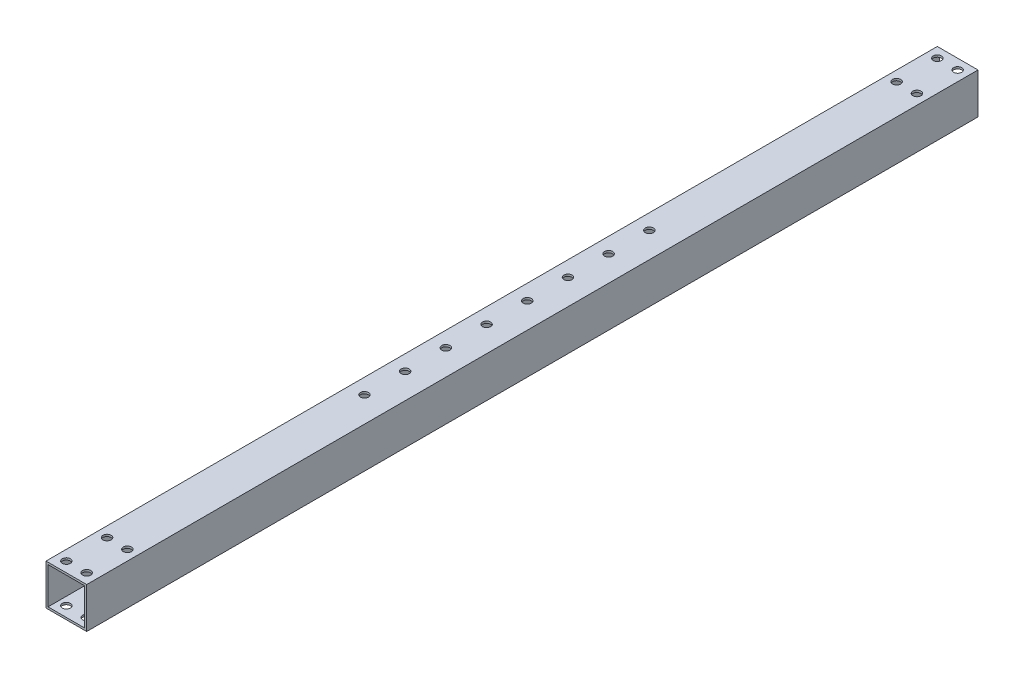
from build123d import *

# Parameters (mm, degrees)
SKETCH_1_W          = 20
SKETCH_1_H          = 20
SKETCH_1_W_2        = 18
SKETCH_1_H_2        = 18
EXTRUDE_1_DEPTH     = 438
SKETCH_4_R          = 2
CUT_EXTRUDE_1_DEPTH = 439.912291922


with BuildPart() as part:
    # 草图1 → 拉伸-薄壁1 (new body)
    with BuildSketch(Plane.XY):
        with Locations((10, 10)):
            Rectangle(SKETCH_1_W, SKETCH_1_H)
        with Locations((10, 10)):
            Rectangle(SKETCH_1_W_2, SKETCH_1_H_2, mode=Mode.SUBTRACT)
    extrude(amount=EXTRUDE_1_DEPTH)

    # 草图4 → 切除-拉伸1 (cut, through all)
    with BuildSketch(Plane(origin=(0, 20, 0), x_dir=(1, 0, 0), z_dir=(0, 1, 0))):
        with Locations(Location((5, -413, 0), (0, 0, 270))):
            Circle(SKETCH_4_R)
        with Locations(Location((15, -413, 0), (0, 0, 270))):
            Circle(SKETCH_4_R)
        with Locations(Location((15, -433, 0), (0, 0, 270))):
            Circle(SKETCH_4_R)
        with Locations(Location((5, -433, 0), (0, 0, 270))):
            Circle(SKETCH_4_R)
        with Locations(Location((5, -5, 0), (0, 0, 90))):
            Circle(SKETCH_4_R)
        with Locations(Location((15, -5, 0), (0, 0, 90))):
            Circle(SKETCH_4_R)
        with Locations(Location((15, -25, 0), (0, 0, 90))):
            Circle(SKETCH_4_R)
        with Locations(Location((5, -25, 0), (0, 0, 90))):
            Circle(SKETCH_4_R)
        with Locations(Location((7.5, -149, 0), (0, 0, 270))):
            Circle(SKETCH_4_R)
        with Locations(Location((7.5, -169, 0), (0, 0, 270))):
            Circle(SKETCH_4_R)
        with Locations(Location((7.5, -189, 0), (0, 0, 270))):
            Circle(SKETCH_4_R)
        with Locations(Location((7.5, -209, 0), (0, 0, 270))):
            Circle(SKETCH_4_R)
        with Locations(Location((7.5, -229, 0), (0, 0, 90))):
            Circle(SKETCH_4_R)
        with Locations(Location((7.5, -249, 0), (0, 0, 90))):
            Circle(SKETCH_4_R)
        with Locations(Location((7.5, -269, 0), (0, 0, 90))):
            Circle(SKETCH_4_R)
        with Locations(Location((7.5, -289, 0), (0, 0, 90))):
            Circle(SKETCH_4_R)
    extrude(amount=-CUT_EXTRUDE_1_DEPTH, mode=Mode.SUBTRACT)


solid = part.part
